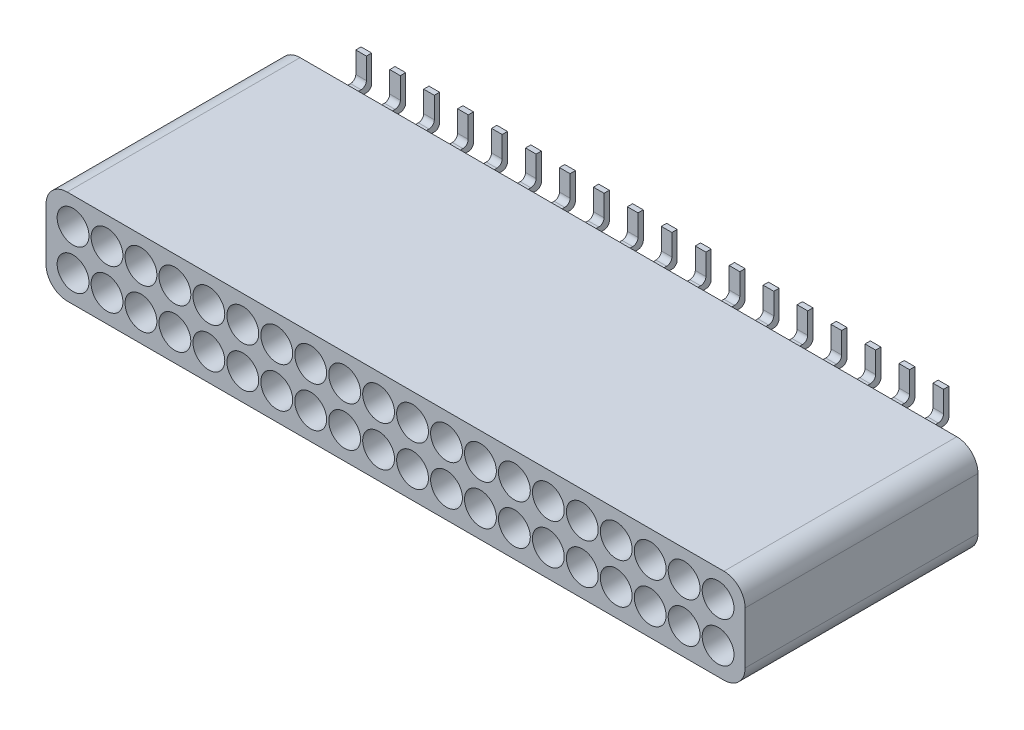
from build123d import *

# Parameters (mm, degrees)
SKETCH1_W             = 13.18
SKETCH1_H             = 1.78
BOSS_EXTRUDE1_DEPTH   = 4.39
BOSS_EXTRUDE3_DEPTH   = 0.2
LPATTERN2_COUNT       = 18
LPATTERN2_PITCH       = 0.64
MIRROR1_COPY_1_DEPTH  = 0.2
MIRROR1_COPY_2_DEPTH  = 0.2
MIRROR1_COPY_3_DEPTH  = 0.2
MIRROR1_COPY_4_DEPTH  = 0.2
MIRROR1_COPY_5_DEPTH  = 0.2
MIRROR1_COPY_6_DEPTH  = 0.2
MIRROR1_COPY_7_DEPTH  = 0.2
MIRROR1_COPY_8_DEPTH  = 0.2
MIRROR1_COPY_9_DEPTH  = 0.2
MIRROR1_COPY_10_DEPTH = 0.2
MIRROR1_COPY_11_DEPTH = 0.2
MIRROR1_COPY_12_DEPTH = 0.2
MIRROR1_COPY_13_DEPTH = 0.2
MIRROR1_COPY_14_DEPTH = 0.2
MIRROR1_COPY_15_DEPTH = 0.2
MIRROR1_COPY_16_DEPTH = 0.2
MIRROR1_COPY_17_DEPTH = 0.2
SKETCH3_R             = 0.3
CUT_EXTRUDE1_DEPTH    = 3
LPATTERN1_COUNT       = 20
LPATTERN1_PITCH       = 0.64
LPATTERN1_COUNT_DIR2  = 2
LPATTERN1_PITCH_DIR2  = 0.76
FILLET1_R             = 0.4


with BuildPart() as part:
    # Sketch1 → Boss-Extrude1 (new body)
    with BuildSketch(Plane.XY):
        Rectangle(SKETCH1_W, SKETCH1_H)
    extrude(amount=BOSS_EXTRUDE1_DEPTH)

    # Sketch12 → Boss-Extrude3 (add)
    with BuildSketch(Plane(origin=(5.54, 0, 0), x_dir=(0, 0, -1), z_dir=(1, 0, 0))):
        with BuildLine():
            Line((0, 0.54), (0.4, 0.54))
            ThreePointArc((0.4, 0.54), (0.470710678, 0.569289322), (0.5, 0.64))
            Line((0.5, 0.64), (0.5, 1.14))
            Line((0.5, 1.14), (0.4, 1.14))
            Line((0.4, 1.14), (0.4, 0.74))
            ThreePointArc((0.4, 0.74), (0.370710678, 0.669289322), (0.3, 0.64))
            Line((0.3, 0.64), (0, 0.64))
            Line((0, 0.64), (0, 0.54))
        make_face()
    boss_extrude3 = extrude(amount=-BOSS_EXTRUDE3_DEPTH)

    # LPattern2: Boss-Extrude3 ×18
    with Locations(*[(-i * LPATTERN2_PITCH, 0, 0) for i in range(1, LPATTERN2_COUNT)]):
        add(boss_extrude3)

    # Mirror1: Boss-Extrude3 across plane
    add(boss_extrude3.mirror(Plane.ZX))

    # Mirror1 copy 1 sketch → Mirror1 copy 1 (add)
    with BuildSketch(Plane(origin=(4.9, 0, 0), x_dir=(0, 0, -1), z_dir=(1, 0, 0))):
        with BuildLine():
            Line((0, -0.54), (0.4, -0.54))
            ThreePointArc((0.4, -0.54), (0.470710678, -0.569289322), (0.5, -0.64))
            Line((0.5, -0.64), (0.5, -1.14))
            Line((0.5, -1.14), (0.4, -1.14))
            Line((0.4, -1.14), (0.4, -0.74))
            ThreePointArc((0.4, -0.74), (0.370710678, -0.669289322), (0.3, -0.64))
            Line((0.3, -0.64), (0, -0.64))
            Line((0, -0.64), (0, -0.54))
        make_face()
    extrude(amount=-MIRROR1_COPY_1_DEPTH)

    # Mirror1 copy 2 sketch → Mirror1 copy 2 (add)
    with BuildSketch(Plane(origin=(4.26, 0, 0), x_dir=(0, 0, -1), z_dir=(1, 0, 0))):
        with BuildLine():
            Line((0, -0.54), (0.4, -0.54))
            ThreePointArc((0.4, -0.54), (0.470710678, -0.569289322), (0.5, -0.64))
            Line((0.5, -0.64), (0.5, -1.14))
            Line((0.5, -1.14), (0.4, -1.14))
            Line((0.4, -1.14), (0.4, -0.74))
            ThreePointArc((0.4, -0.74), (0.370710678, -0.669289322), (0.3, -0.64))
            Line((0.3, -0.64), (0, -0.64))
            Line((0, -0.64), (0, -0.54))
        make_face()
    extrude(amount=-MIRROR1_COPY_2_DEPTH)

    # Mirror1 copy 3 sketch → Mirror1 copy 3 (add)
    with BuildSketch(Plane(origin=(3.62, 0, 0), x_dir=(0, 0, -1), z_dir=(1, 0, 0))):
        with BuildLine():
            Line((0, -0.54), (0.4, -0.54))
            ThreePointArc((0.4, -0.54), (0.470710678, -0.569289322), (0.5, -0.64))
            Line((0.5, -0.64), (0.5, -1.14))
            Line((0.5, -1.14), (0.4, -1.14))
            Line((0.4, -1.14), (0.4, -0.74))
            ThreePointArc((0.4, -0.74), (0.370710678, -0.669289322), (0.3, -0.64))
            Line((0.3, -0.64), (0, -0.64))
            Line((0, -0.64), (0, -0.54))
        make_face()
    extrude(amount=-MIRROR1_COPY_3_DEPTH)

    # Mirror1 copy 4 sketch → Mirror1 copy 4 (add)
    with BuildSketch(Plane(origin=(2.98, 0, 0), x_dir=(0, 0, -1), z_dir=(1, 0, 0))):
        with BuildLine():
            Line((0, -0.54), (0.4, -0.54))
            ThreePointArc((0.4, -0.54), (0.470710678, -0.569289322), (0.5, -0.64))
            Line((0.5, -0.64), (0.5, -1.14))
            Line((0.5, -1.14), (0.4, -1.14))
            Line((0.4, -1.14), (0.4, -0.74))
            ThreePointArc((0.4, -0.74), (0.370710678, -0.669289322), (0.3, -0.64))
            Line((0.3, -0.64), (0, -0.64))
            Line((0, -0.64), (0, -0.54))
        make_face()
    extrude(amount=-MIRROR1_COPY_4_DEPTH)

    # Mirror1 copy 5 sketch → Mirror1 copy 5 (add)
    with BuildSketch(Plane(origin=(2.34, 0, 0), x_dir=(0, 0, -1), z_dir=(1, 0, 0))):
        with BuildLine():
            Line((0, -0.54), (0.4, -0.54))
            ThreePointArc((0.4, -0.54), (0.470710678, -0.569289322), (0.5, -0.64))
            Line((0.5, -0.64), (0.5, -1.14))
            Line((0.5, -1.14), (0.4, -1.14))
            Line((0.4, -1.14), (0.4, -0.74))
            ThreePointArc((0.4, -0.74), (0.370710678, -0.669289322), (0.3, -0.64))
            Line((0.3, -0.64), (0, -0.64))
            Line((0, -0.64), (0, -0.54))
        make_face()
    extrude(amount=-MIRROR1_COPY_5_DEPTH)

    # Mirror1 copy 6 sketch → Mirror1 copy 6 (add)
    with BuildSketch(Plane(origin=(1.7, 0, 0), x_dir=(0, 0, -1), z_dir=(1, 0, 0))):
        with BuildLine():
            Line((0, -0.54), (0.4, -0.54))
            ThreePointArc((0.4, -0.54), (0.470710678, -0.569289322), (0.5, -0.64))
            Line((0.5, -0.64), (0.5, -1.14))
            Line((0.5, -1.14), (0.4, -1.14))
            Line((0.4, -1.14), (0.4, -0.74))
            ThreePointArc((0.4, -0.74), (0.370710678, -0.669289322), (0.3, -0.64))
            Line((0.3, -0.64), (0, -0.64))
            Line((0, -0.64), (0, -0.54))
        make_face()
    extrude(amount=-MIRROR1_COPY_6_DEPTH)

    # Mirror1 copy 7 sketch → Mirror1 copy 7 (add)
    with BuildSketch(Plane(origin=(1.06, 0, 0), x_dir=(0, 0, -1), z_dir=(1, 0, 0))):
        with BuildLine():
            Line((0, -0.54), (0.4, -0.54))
            ThreePointArc((0.4, -0.54), (0.470710678, -0.569289322), (0.5, -0.64))
            Line((0.5, -0.64), (0.5, -1.14))
            Line((0.5, -1.14), (0.4, -1.14))
            Line((0.4, -1.14), (0.4, -0.74))
            ThreePointArc((0.4, -0.74), (0.370710678, -0.669289322), (0.3, -0.64))
            Line((0.3, -0.64), (0, -0.64))
            Line((0, -0.64), (0, -0.54))
        make_face()
    extrude(amount=-MIRROR1_COPY_7_DEPTH)

    # Mirror1 copy 8 sketch → Mirror1 copy 8 (add)
    with BuildSketch(Plane(origin=(0.42, 0, 0), x_dir=(0, 0, -1), z_dir=(1, 0, 0))):
        with BuildLine():
            Line((0, -0.54), (0.4, -0.54))
            ThreePointArc((0.4, -0.54), (0.470710678, -0.569289322), (0.5, -0.64))
            Line((0.5, -0.64), (0.5, -1.14))
            Line((0.5, -1.14), (0.4, -1.14))
            Line((0.4, -1.14), (0.4, -0.74))
            ThreePointArc((0.4, -0.74), (0.370710678, -0.669289322), (0.3, -0.64))
            Line((0.3, -0.64), (0, -0.64))
            Line((0, -0.64), (0, -0.54))
        make_face()
    extrude(amount=-MIRROR1_COPY_8_DEPTH)

    # Mirror1 copy 9 sketch → Mirror1 copy 9 (add)
    with BuildSketch(Plane(origin=(-0.22, 0, 0), x_dir=(0, 0, -1), z_dir=(1, 0, 0))):
        with BuildLine():
            Line((0, -0.54), (0.4, -0.54))
            ThreePointArc((0.4, -0.54), (0.470710678, -0.569289322), (0.5, -0.64))
            Line((0.5, -0.64), (0.5, -1.14))
            Line((0.5, -1.14), (0.4, -1.14))
            Line((0.4, -1.14), (0.4, -0.74))
            ThreePointArc((0.4, -0.74), (0.370710678, -0.669289322), (0.3, -0.64))
            Line((0.3, -0.64), (0, -0.64))
            Line((0, -0.64), (0, -0.54))
        make_face()
    extrude(amount=-MIRROR1_COPY_9_DEPTH)

    # Mirror1 copy 10 sketch → Mirror1 copy 10 (add)
    with BuildSketch(Plane(origin=(-0.86, 0, 0), x_dir=(0, 0, -1), z_dir=(1, 0, 0))):
        with BuildLine():
            Line((0, -0.54), (0.4, -0.54))
            ThreePointArc((0.4, -0.54), (0.470710678, -0.569289322), (0.5, -0.64))
            Line((0.5, -0.64), (0.5, -1.14))
            Line((0.5, -1.14), (0.4, -1.14))
            Line((0.4, -1.14), (0.4, -0.74))
            ThreePointArc((0.4, -0.74), (0.370710678, -0.669289322), (0.3, -0.64))
            Line((0.3, -0.64), (0, -0.64))
            Line((0, -0.64), (0, -0.54))
        make_face()
    extrude(amount=-MIRROR1_COPY_10_DEPTH)

    # Mirror1 copy 11 sketch → Mirror1 copy 11 (add)
    with BuildSketch(Plane(origin=(-1.5, 0, 0), x_dir=(0, 0, -1), z_dir=(1, 0, 0))):
        with BuildLine():
            Line((0, -0.54), (0.4, -0.54))
            ThreePointArc((0.4, -0.54), (0.470710678, -0.569289322), (0.5, -0.64))
            Line((0.5, -0.64), (0.5, -1.14))
            Line((0.5, -1.14), (0.4, -1.14))
            Line((0.4, -1.14), (0.4, -0.74))
            ThreePointArc((0.4, -0.74), (0.370710678, -0.669289322), (0.3, -0.64))
            Line((0.3, -0.64), (0, -0.64))
            Line((0, -0.64), (0, -0.54))
        make_face()
    extrude(amount=-MIRROR1_COPY_11_DEPTH)

    # Mirror1 copy 12 sketch → Mirror1 copy 12 (add)
    with BuildSketch(Plane(origin=(-2.14, 0, 0), x_dir=(0, 0, -1), z_dir=(1, 0, 0))):
        with BuildLine():
            Line((0, -0.54), (0.4, -0.54))
            ThreePointArc((0.4, -0.54), (0.470710678, -0.569289322), (0.5, -0.64))
            Line((0.5, -0.64), (0.5, -1.14))
            Line((0.5, -1.14), (0.4, -1.14))
            Line((0.4, -1.14), (0.4, -0.74))
            ThreePointArc((0.4, -0.74), (0.370710678, -0.669289322), (0.3, -0.64))
            Line((0.3, -0.64), (0, -0.64))
            Line((0, -0.64), (0, -0.54))
        make_face()
    extrude(amount=-MIRROR1_COPY_12_DEPTH)

    # Mirror1 copy 13 sketch → Mirror1 copy 13 (add)
    with BuildSketch(Plane(origin=(-2.78, 0, 0), x_dir=(0, 0, -1), z_dir=(1, 0, 0))):
        with BuildLine():
            Line((0, -0.54), (0.4, -0.54))
            ThreePointArc((0.4, -0.54), (0.470710678, -0.569289322), (0.5, -0.64))
            Line((0.5, -0.64), (0.5, -1.14))
            Line((0.5, -1.14), (0.4, -1.14))
            Line((0.4, -1.14), (0.4, -0.74))
            ThreePointArc((0.4, -0.74), (0.370710678, -0.669289322), (0.3, -0.64))
            Line((0.3, -0.64), (0, -0.64))
            Line((0, -0.64), (0, -0.54))
        make_face()
    extrude(amount=-MIRROR1_COPY_13_DEPTH)

    # Mirror1 copy 14 sketch → Mirror1 copy 14 (add)
    with BuildSketch(Plane(origin=(-3.42, 0, 0), x_dir=(0, 0, -1), z_dir=(1, 0, 0))):
        with BuildLine():
            Line((0, -0.54), (0.4, -0.54))
            ThreePointArc((0.4, -0.54), (0.470710678, -0.569289322), (0.5, -0.64))
            Line((0.5, -0.64), (0.5, -1.14))
            Line((0.5, -1.14), (0.4, -1.14))
            Line((0.4, -1.14), (0.4, -0.74))
            ThreePointArc((0.4, -0.74), (0.370710678, -0.669289322), (0.3, -0.64))
            Line((0.3, -0.64), (0, -0.64))
            Line((0, -0.64), (0, -0.54))
        make_face()
    extrude(amount=-MIRROR1_COPY_14_DEPTH)

    # Mirror1 copy 15 sketch → Mirror1 copy 15 (add)
    with BuildSketch(Plane(origin=(-4.06, 0, 0), x_dir=(0, 0, -1), z_dir=(1, 0, 0))):
        with BuildLine():
            Line((0, -0.54), (0.4, -0.54))
            ThreePointArc((0.4, -0.54), (0.470710678, -0.569289322), (0.5, -0.64))
            Line((0.5, -0.64), (0.5, -1.14))
            Line((0.5, -1.14), (0.4, -1.14))
            Line((0.4, -1.14), (0.4, -0.74))
            ThreePointArc((0.4, -0.74), (0.370710678, -0.669289322), (0.3, -0.64))
            Line((0.3, -0.64), (0, -0.64))
            Line((0, -0.64), (0, -0.54))
        make_face()
    extrude(amount=-MIRROR1_COPY_15_DEPTH)

    # Mirror1 copy 16 sketch → Mirror1 copy 16 (add)
    with BuildSketch(Plane(origin=(-4.7, 0, 0), x_dir=(0, 0, -1), z_dir=(1, 0, 0))):
        with BuildLine():
            Line((0, -0.54), (0.4, -0.54))
            ThreePointArc((0.4, -0.54), (0.470710678, -0.569289322), (0.5, -0.64))
            Line((0.5, -0.64), (0.5, -1.14))
            Line((0.5, -1.14), (0.4, -1.14))
            Line((0.4, -1.14), (0.4, -0.74))
            ThreePointArc((0.4, -0.74), (0.370710678, -0.669289322), (0.3, -0.64))
            Line((0.3, -0.64), (0, -0.64))
            Line((0, -0.64), (0, -0.54))
        make_face()
    extrude(amount=-MIRROR1_COPY_16_DEPTH)

    # Mirror1 copy 17 sketch → Mirror1 copy 17 (add)
    with BuildSketch(Plane(origin=(-5.34, 0, 0), x_dir=(0, 0, -1), z_dir=(1, 0, 0))):
        with BuildLine():
            Line((0, -0.54), (0.4, -0.54))
            ThreePointArc((0.4, -0.54), (0.470710678, -0.569289322), (0.5, -0.64))
            Line((0.5, -0.64), (0.5, -1.14))
            Line((0.5, -1.14), (0.4, -1.14))
            Line((0.4, -1.14), (0.4, -0.74))
            ThreePointArc((0.4, -0.74), (0.370710678, -0.669289322), (0.3, -0.64))
            Line((0.3, -0.64), (0, -0.64))
            Line((0, -0.64), (0, -0.54))
        make_face()
    extrude(amount=-MIRROR1_COPY_17_DEPTH)

    # Sketch3 → Cut-Extrude1 (cut)
    with BuildSketch(Plane.XY.offset(4.39)):
        with Locations((6.08, -0.38)):
            Circle(SKETCH3_R)
    cut_extrude1 = extrude(amount=-CUT_EXTRUDE1_DEPTH, mode=Mode.SUBTRACT)

    # LPattern1: Cut-Extrude1 20 × 2
    with Locations(*[(-i * LPATTERN1_PITCH, j * LPATTERN1_PITCH_DIR2, 0) for i in range(LPATTERN1_COUNT) for j in range(LPATTERN1_COUNT_DIR2) if (i, j) != (0, 0)]):
        add(cut_extrude1, mode=Mode.SUBTRACT)

    # Fillet1
    fillet1_edges = [part.edges().sort_by_distance(p)[0] for p in [
        (-6.59, 0.89, 2.195),
        (6.59, 0.89, 2.195),
        (6.59, -0.89, 2.195),
        (-6.59, -0.89, 2.195),
    ]]
    fillet(fillet1_edges, radius=FILLET1_R)


with BuildPart() as part_1:
    # Body-Move/Copy1: moved
    add(part.part.moved(Location((0, 0, 0.5))))


solid = part_1.part
